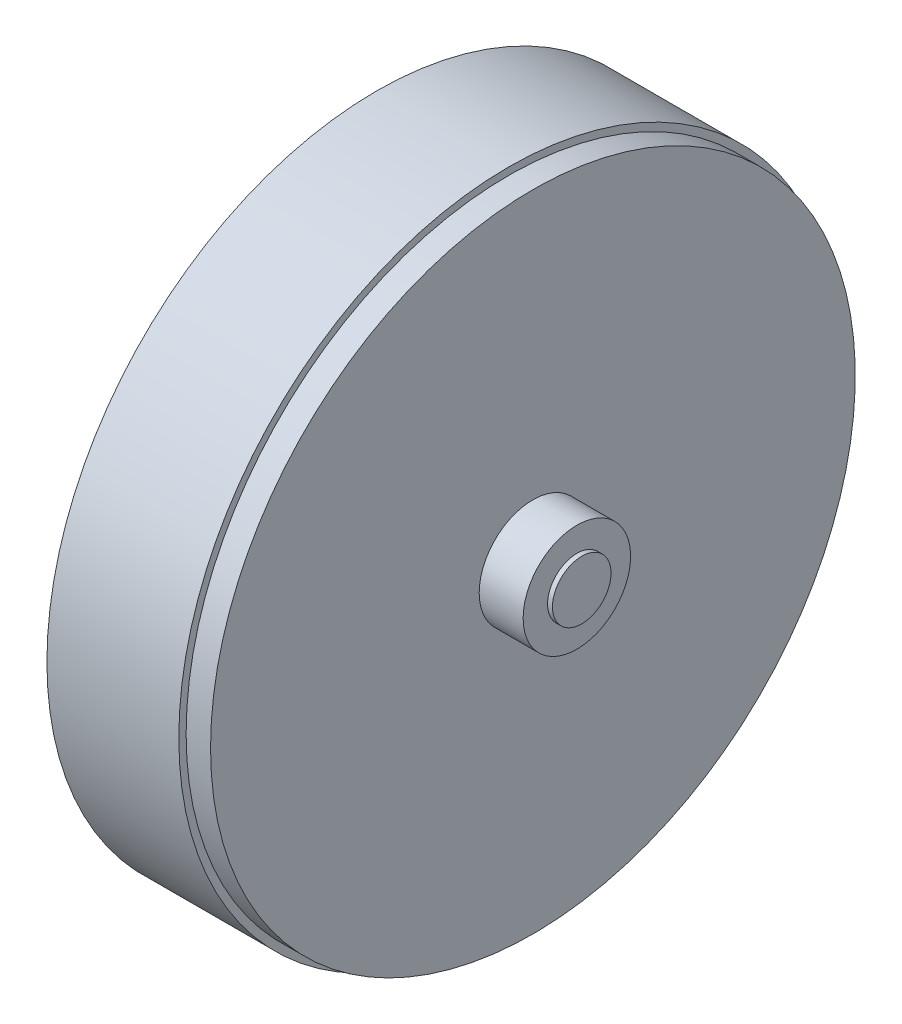
from build123d import *

# Parameters (mm, degrees)
SKETCH2_R          = 1.25
CUT_EXTRUDE1_DEPTH = 4


with BuildPart() as part:
    # Sketch1 → Revolve1 (revolve)
    with BuildSketch(Plane.XY, mode=Mode.PRIVATE) as revolve1_sk:
        Polygon((0, 0), (0, 3), (-0.5, 3), (-0.5, 5.5), (-5, 5.5), (-5, 33), (-7.5, 33), (-7.5, 33.75), (-21, 33.75), (-21, 22), (-25, 22), (-25, 18), (-27, 18), (-27, 17), (-30.5, 17), (-30.5, 0), align=None)
    revolve(revolve1_sk.sketch.rotate(Axis((-34.008884984, 0, 0), (1, 0, 0)), 90), axis=Axis((-34.008884984, 0, 0), (1, 0, 0)))

    # Sketch2 → Cut-Extrude1 (cut)
    with BuildSketch(Plane.ZY.offset(25)):
        with Locations((-7.749339505, 18.708560533)):
            Circle(SKETCH2_R)
        with Locations((7.749339505, 18.708560533)):
            Circle(SKETCH2_R)
        with Locations((18.708560533, 7.749339505)):
            Circle(SKETCH2_R)
        with Locations((18.708560533, -7.749339505)):
            Circle(SKETCH2_R)
        with Locations((7.749339505, -18.708560533)):
            Circle(SKETCH2_R)
        with Locations((-7.749339505, -18.708560533)):
            Circle(SKETCH2_R)
        with Locations((-18.708560533, -7.749339505)):
            Circle(SKETCH2_R)
        with Locations((-18.708560533, 7.749339505)):
            Circle(SKETCH2_R)
    extrude(amount=-CUT_EXTRUDE1_DEPTH, mode=Mode.SUBTRACT)


solid = part.part
